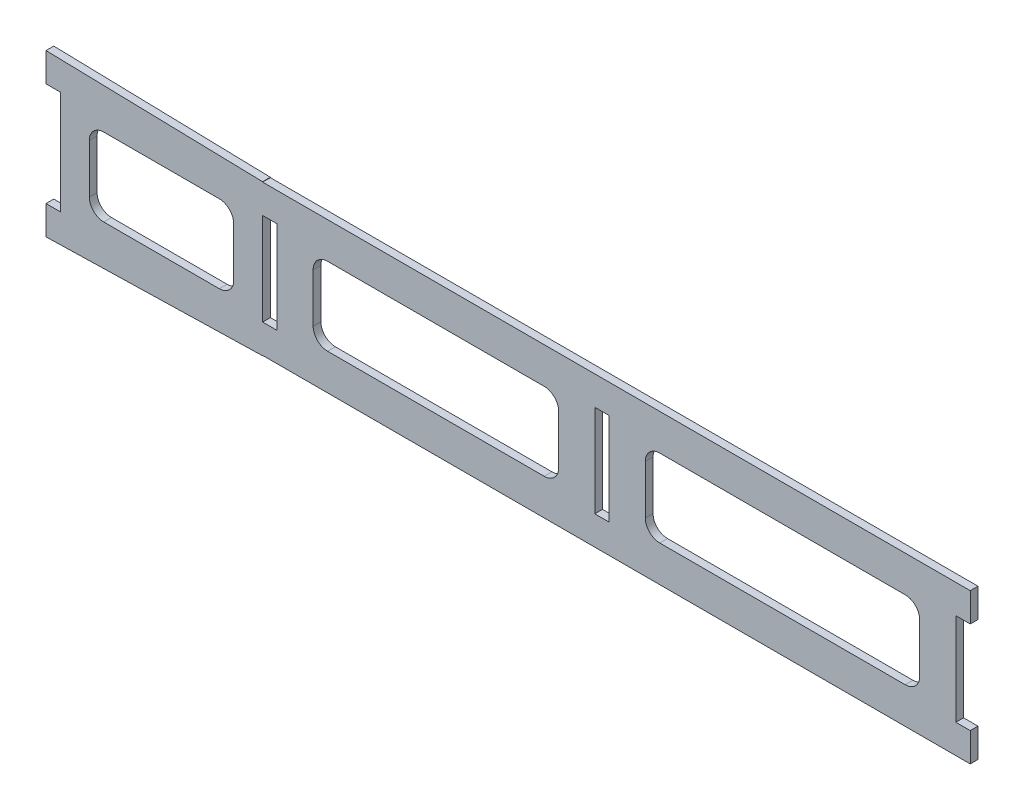
from build123d import *

# Parameters (mm, degrees)
SKETCH1_W           = 6.35
SKETCH1_H           = 40.5892
BOSS_EXTRUDE1_DEPTH = 3.4036


with BuildPart() as part:
    # Sketch1 → Boss-Extrude1 (new body)
    with BuildSketch(Plane.XY):
        Polygon((8565.704586486, 2936.318079168), (8660.954586486, 2933.984454168), (8660.954586486, 2933.828879168), (8972.104586486, 2933.828879168), (8972.104586486, 2921.128879168), (8965.754586486, 2921.128879168), (8965.754586486, 2880.539679168), (8972.104586486, 2880.539679168), (8972.104586486, 2867.839679168), (8660.954586486, 2867.839679168), (8660.954586486, 2867.684104168), (8565.704586486, 2865.350479168), (8565.704586486, 2878.050479168), (8572.054586486, 2878.050479168), (8572.054586486, 2923.618079168), (8565.704586486, 2923.618079168), align=None)
        with Locations((8664.129586486, 2900.834279168)):
            Rectangle(SKETCH1_W, SKETCH1_H, mode=Mode.SUBTRACT)
        with BuildLine():
            Line((8683.179586486, 2890.064679168), (8683.179586486, 2911.603879168))
            ThreePointArc((8683.179586486, 2911.603879168), (8685.039458425, 2916.094007229), (8689.529586486, 2917.953879168))
            Line((8689.529586486, 2917.953879168), (8784.779586486, 2917.953879168))
            ThreePointArc((8784.779586486, 2917.953879168), (8789.269714547, 2916.094007229), (8791.129586486, 2911.603879168))
            Line((8791.129586486, 2911.603879168), (8791.129586486, 2890.064679168))
            ThreePointArc((8791.129586486, 2890.064679168), (8789.269714547, 2885.574551108), (8784.779586486, 2883.714679168))
            Line((8784.779586486, 2883.714679168), (8689.529586486, 2883.714679168))
            ThreePointArc((8689.529586486, 2883.714679168), (8685.039458425, 2885.574551108), (8683.179586486, 2890.064679168))
        make_face(mode=Mode.SUBTRACT)
        with BuildLine():
            Line((8648.254586486, 2911.603879168), (8648.254586486, 2890.064679168))
            ThreePointArc((8648.254586486, 2890.064679168), (8646.394714547, 2885.574551108), (8641.904586486, 2883.714679168))
            Line((8641.904586486, 2883.714679168), (8591.104586486, 2883.714679168))
            ThreePointArc((8591.104586486, 2883.714679168), (8586.614458425, 2885.574551108), (8584.754586486, 2890.064679168))
            Line((8584.754586486, 2890.064679168), (8584.754586486, 2911.603879168))
            ThreePointArc((8584.754586486, 2911.603879168), (8586.614458425, 2916.094007229), (8591.104586486, 2917.953879168))
            Line((8591.104586486, 2917.953879168), (8641.904586486, 2917.953879168))
            ThreePointArc((8641.904586486, 2917.953879168), (8646.394714547, 2916.094007229), (8648.254586486, 2911.603879168))
        make_face(mode=Mode.SUBTRACT)
        with BuildLine():
            Line((8943.529586486, 2917.953879168), (8835.579586486, 2917.953879168))
            ThreePointArc((8835.579586486, 2917.953879168), (8831.089458425, 2916.094007229), (8829.229586486, 2911.603879168))
            Line((8829.229586486, 2911.603879168), (8829.229586486, 2890.064679168))
            ThreePointArc((8829.229586486, 2890.064679168), (8831.089458425, 2885.574551108), (8835.579586486, 2883.714679168))
            Line((8835.579586486, 2883.714679168), (8943.529586486, 2883.714679168))
            ThreePointArc((8943.529586486, 2883.714679168), (8948.019714547, 2885.574551108), (8949.879586486, 2890.064679168))
            Line((8949.879586486, 2890.064679168), (8949.879586486, 2911.603879168))
            ThreePointArc((8949.879586486, 2911.603879168), (8948.019714547, 2916.094007229), (8943.529586486, 2917.953879168))
        make_face(mode=Mode.SUBTRACT)
        with Locations((8810.179586486, 2900.834279168)):
            Rectangle(SKETCH1_W, SKETCH1_H, mode=Mode.SUBTRACT)
    extrude(amount=BOSS_EXTRUDE1_DEPTH)


solid = part.part
